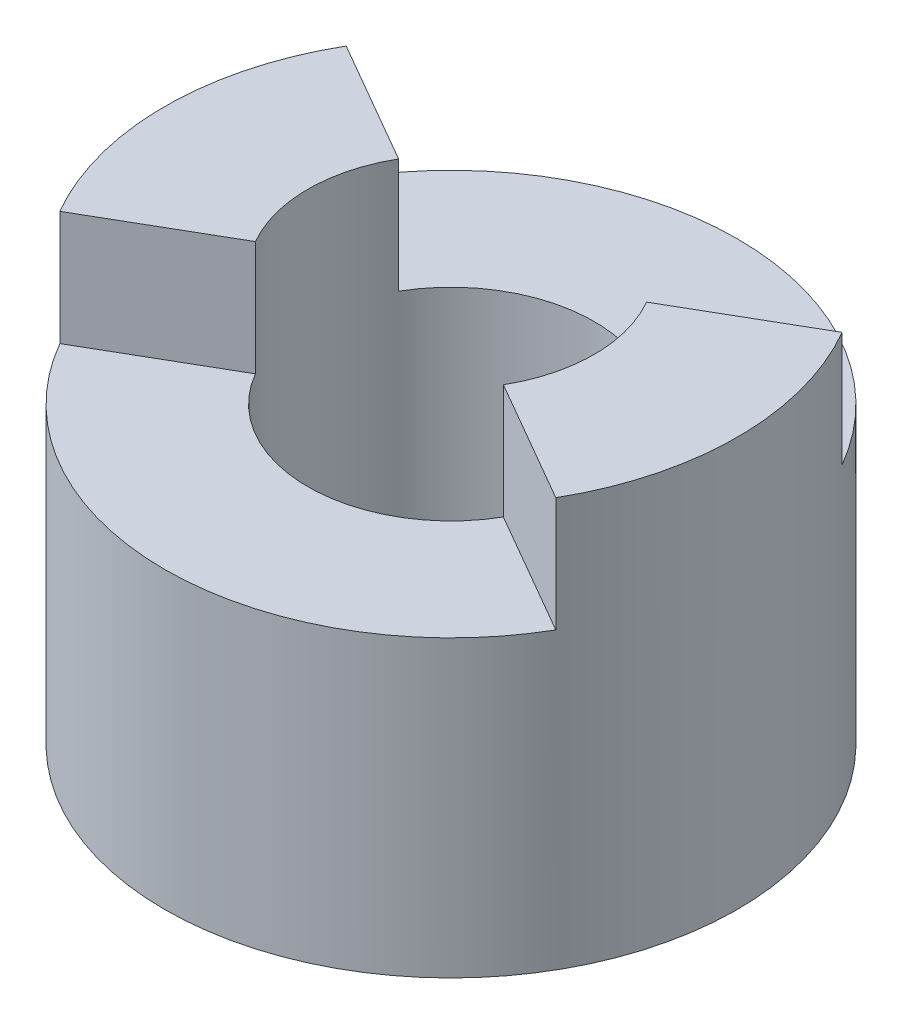
from build123d import *

# Parameters (mm, degrees)
SKETCH1_R           = 35
SKETCH1_R_2         = 17.5
BOSS_EXTRUDE1_DEPTH = 50
CUT_EXTRUDE1_START  = -14
CUT_EXTRUDE1_DEPTH  = 14


with BuildPart() as part:
    # Sketch1 → Boss-Extrude1 (new body)
    with BuildSketch(Plane(origin=(0, 0, 0), x_dir=(1, 0, 0), z_dir=(0, 1, 0))):
        with Locations(Location((0, 0, 0), (0, 0, 270))):
            Circle(SKETCH1_R)
        with Locations(Location((0, 0, 0), (0, 0, 270))):
            Circle(SKETCH1_R_2, mode=Mode.SUBTRACT)
    extrude(amount=BOSS_EXTRUDE1_DEPTH)

    # Sketch2 → Cut-Extrude1 (cut)
    with BuildSketch(Plane(origin=(0, 50, 0), x_dir=(1, 0, 0), z_dir=(0, 1, 0)).offset(CUT_EXTRUDE1_START)):
        with BuildLine():
            Line((15.155444566, -8.75), (30.310889132, -17.5))
            ThreePointArc((30.310889132, -17.5), (0, -35), (-30.310889132, -17.5))
            Line((-30.310889132, -17.5), (-15.155444566, -8.75))
            ThreePointArc((-15.155444566, -8.75), (0, -17.5), (15.155444566, -8.75))
        make_face()
    cut_extrude1 = extrude(amount=CUT_EXTRUDE1_DEPTH, mode=Mode.SUBTRACT)

    # Mirror1: Cut-Extrude1 across plane
    add(cut_extrude1.mirror(Plane.XY), mode=Mode.SUBTRACT)


solid = part.part
